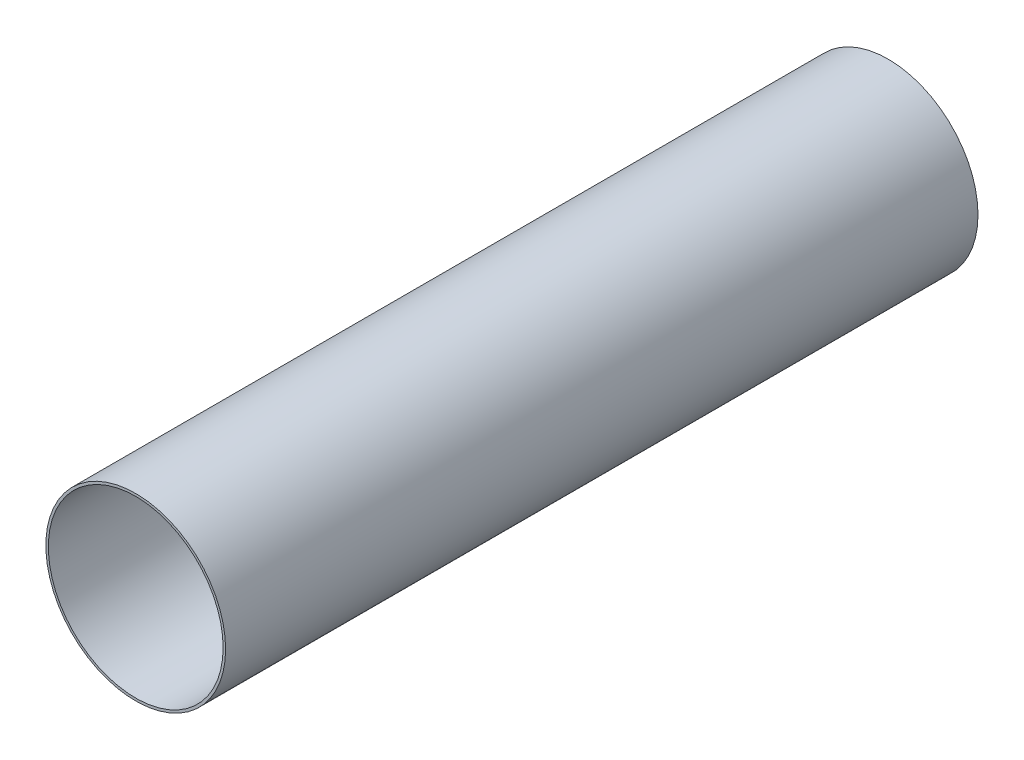
from build123d import *

# Parameters (mm, degrees)
SKETCH1_R           = 78.359
SKETCH1_R_2         = 76.2
BOSS_EXTRUDE1_DEPTH = 655.955


with BuildPart() as part:
    # Sketch1 → Boss-Extrude1 (new body)
    with BuildSketch(Plane.XY):
        Circle(SKETCH1_R)
        Circle(SKETCH1_R_2, mode=Mode.SUBTRACT)
    extrude(amount=BOSS_EXTRUDE1_DEPTH)


solid = part.part
